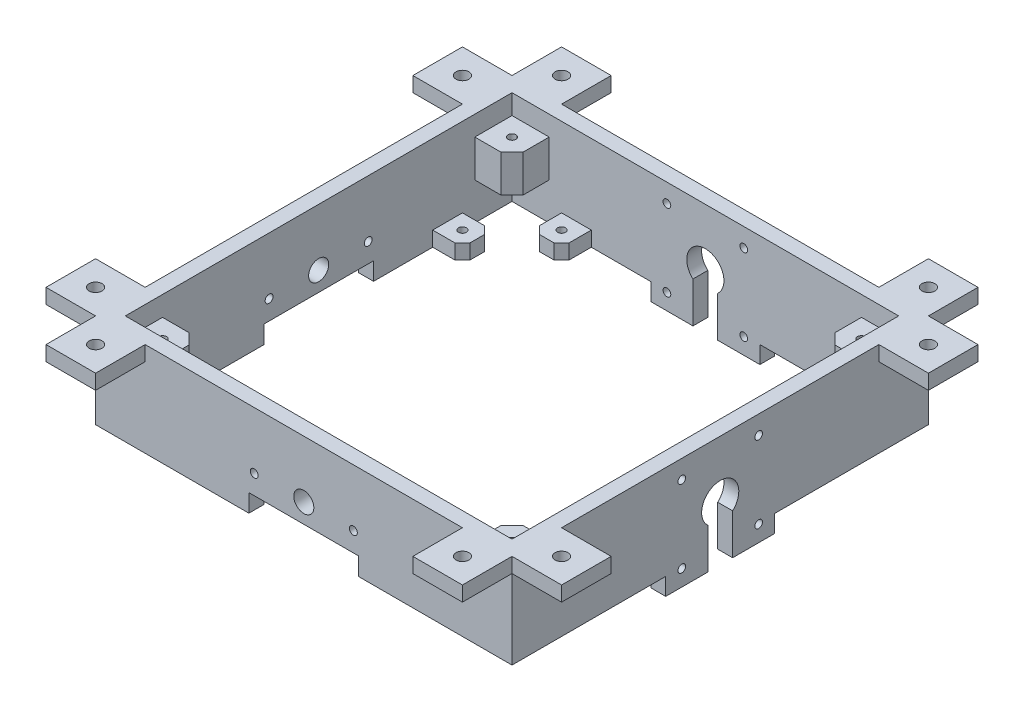
from build123d import *

# Parameters (mm, degrees)
SKETCH_1_W                           = 168
SKETCH_1_H                           = 168
SKETCH_1_W_2                         = 156
SKETCH_1_H_2                         = 156
EXTRUDE_1_DEPTH                      = 38
EXTRUDE_2_DEPTH                      = 15
SKETCH_3_R                           = 1.6
CUT_EXTRUDE_1_DEPTH                  = 122
PATTERN_CIRCULAR_1_COUNT             = 4
SKETCH_8_W                           = 20
SKETCH_8_H                           = 20
SKETCH_8_R                           = 2.6
EXTRUDE_3_DEPTH                      = 6
SKETCH_9_W                           = 20
SKETCH_9_H                           = 20
SKETCH_9_R                           = 2.6
EXTRUDE_4_DEPTH                      = 6
PATTERN_CIRCULAR_2_COUNT             = 4
SKETCH_10_W                          = 44
SKETCH_10_H                          = 7
EXTRUDE_5_DEPTH                      = 6
SKETCH_11_R                          = 1.55
CUT_EXTRUDE_3_DEPTH                  = 6
PATTERN_CIRCULAR_3_COUNT             = 2
PATTERN_CIRCULAR_3_ANGLE             = 90
SKETCH_12_R                          = 4.05
SKETCH_12_W                          = 44.3
SKETCH_12_H                          = 7.2
CUT_EXTRUDE_4_DEPTH                  = 6
SKETCH_16_R                          = 1.6
CUT_EXTRUDE_6_DEPTH                  = 6
PATTERN_CIRCULAR_4_COUNT             = 2
PATTERN_CIRCULAR_4_ANGLE             = 90
SKETCH_13_W                          = 12
SKETCH_13_H                          = 12
EXTRUDE_6_DEPTH                      = 6
SKETCH_15_R                          = 1.6
CUT_EXTRUDE_5_DEPTH                  = 6
CHAMFER_1_SIZE                       = 3
PATTERN_CIRCULAR_5_COUNT             = 4
CHAMFER_1_OF_PATTERN_CIRCULAR_5_SIZE = 3


with BuildPart() as part:
    # 草图1 → 凸台-拉伸1 (new body)
    with BuildSketch(Plane(origin=(0, 0, 0), x_dir=(1, 0, 0), z_dir=(0, 1, 0))):
        Rectangle(SKETCH_1_W, SKETCH_1_H)
        Rectangle(SKETCH_1_W_2, SKETCH_1_H_2, mode=Mode.SUBTRACT)
    extrude(amount=EXTRUDE_1_DEPTH)

    # 草图2 → 凸台-拉伸2 (add)
    with BuildSketch(Plane(origin=(0, 30, 0), x_dir=(1, 0, 0), z_dir=(0, 1, 0))):
        Polygon((-67.384062043, 63), (-78, 63), (-78, 78), (-63, 78), (-63, 67.384062043), align=None)
        Polygon((67.384062043, 63), (63, 67.384062043), (63, 78), (78, 78), (78, 63), align=None)
        Polygon((63, -67.384062043), (67.384062043, -63), (78, -63), (78, -78), (63, -78), align=None)
        Polygon((-67.384062043, -63), (-63, -67.384062043), (-63, -78), (-78, -78), (-78, -63), align=None)
    extrude(amount=-EXTRUDE_2_DEPTH)

    # 草图3 → 切除-拉伸1 (cut, through all)
    with BuildSketch(Plane(origin=(0, 15, 0), x_dir=(-1, 0, 0), z_dir=(0, -1, 0))):
        with Locations(Location((70.5, 70.5, 0), (0, 0, 90))):
            Circle(SKETCH_3_R)
    cut_extrude_1 = extrude(amount=-CUT_EXTRUDE_1_DEPTH, mode=Mode.SUBTRACT)

    # 阵列(圆周)1: 切除-拉伸1 ×4 about axis
    pattern_circular_1_axis = Axis((0, 0, 0), (0, 1, 0))
    for i in range(1, PATTERN_CIRCULAR_1_COUNT):
        add(cut_extrude_1.rotate(pattern_circular_1_axis, i * 360 / PATTERN_CIRCULAR_1_COUNT), mode=Mode.SUBTRACT)

    # 草图8 → 凸台-拉伸3 (add)
    with BuildSketch(Plane(origin=(0, 38, 0), x_dir=(1, 0, 0), z_dir=(0, 1, 0))):
        with Locations((-94, 74)):
            Rectangle(SKETCH_8_W, SKETCH_8_H)
        with Locations(Location((-94, 74, 0), (0, 0, 270))):
            Circle(SKETCH_8_R, mode=Mode.SUBTRACT)
    extrude_3 = extrude(amount=-EXTRUDE_3_DEPTH)

    # 草图9 → 凸台-拉伸4 (add)
    with BuildSketch(Plane(origin=(0, 38, 0), x_dir=(1, 0, 0), z_dir=(0, 1, 0))):
        with Locations((-74, 94)):
            Rectangle(SKETCH_9_W, SKETCH_9_H)
        with Locations(Location((-74, 94, 0), (0, 0, 270))):
            Circle(SKETCH_9_R, mode=Mode.SUBTRACT)
    extrude_4 = extrude(amount=-EXTRUDE_4_DEPTH)

    # 阵列(圆周)2: 凸台-拉伸3, 凸台-拉伸4 ×4 about axis
    pattern_circular_2_axis = Axis((0, 0, 0), (0, 1, 0))
    add([extrude_3.rotate(pattern_circular_2_axis, i * 360 / PATTERN_CIRCULAR_2_COUNT) for i in range(1, PATTERN_CIRCULAR_2_COUNT)])
    add([extrude_4.rotate(pattern_circular_2_axis, i * 360 / PATTERN_CIRCULAR_2_COUNT) for i in range(1, PATTERN_CIRCULAR_2_COUNT)])

    # 草图10 → 凸台-拉伸5 (add)
    with BuildSketch(Plane(origin=(0, 0, -84), x_dir=(-1, 0, 0), z_dir=(0, 0, -1))):
        with Locations((0, -3.5)):
            Rectangle(SKETCH_10_W, SKETCH_10_H)
    extrude_5 = extrude(amount=-EXTRUDE_5_DEPTH)

    # 草图11 → 切除-拉伸3 (cut)
    with BuildSketch(Plane(origin=(0, 0, -84), x_dir=(-1, 0, 0), z_dir=(0, 0, -1))):
        with Locations((-15.5, 30.5)):
            Circle(SKETCH_11_R)
        with Locations(Location((15.5, 30.5, 0), (0, 0, 180))):
            Circle(SKETCH_11_R)
        with Locations((15.5, -0.5)):
            Circle(SKETCH_11_R)
        with Locations(Location((-15.5, -0.5, 0), (0, 0, 180))):
            Circle(SKETCH_11_R)
        with BuildLine():
            Line((-5, -7), (-5, 9.409830056))
            ThreePointArc((-5, 9.409830056), (0, 22.5), (5, 9.409830056))
            Line((5, 9.409830056), (5, -7))
            Line((5, -7), (-5, -7))
        make_face()
    cut_extrude_3 = extrude(amount=-CUT_EXTRUDE_3_DEPTH, mode=Mode.SUBTRACT)

    # 阵列(圆周)3: 凸台-拉伸5, 切除-拉伸3 ×2 about axis
    pattern_circular_3_axis = Axis((0, 0, 0), (0, -1, 0))
    add([extrude_5.rotate(pattern_circular_3_axis, i * PATTERN_CIRCULAR_3_ANGLE / (PATTERN_CIRCULAR_3_COUNT - 1)) for i in range(1, PATTERN_CIRCULAR_3_COUNT)])
    add([cut_extrude_3.rotate(pattern_circular_3_axis, i * PATTERN_CIRCULAR_3_ANGLE / (PATTERN_CIRCULAR_3_COUNT - 1)) for i in range(1, PATTERN_CIRCULAR_3_COUNT)], mode=Mode.SUBTRACT)

    # 草图12 → 切除-拉伸4 (cut)
    with BuildSketch(Plane.XY.offset(84)):
        with Locations((0, 15)):
            Circle(SKETCH_12_R)
        with Locations((0, 3.6)):
            Rectangle(SKETCH_12_W, SKETCH_12_H)
    cut_extrude_4 = extrude(amount=-CUT_EXTRUDE_4_DEPTH, mode=Mode.SUBTRACT)

    # 草图16 → 切除-拉伸6 (cut)
    with BuildSketch(Plane.XY.offset(84)):
        with Locations((-20, 15)):
            Circle(SKETCH_16_R)
        with Locations(Location((20, 15, 0), (0, 0, 180))):
            Circle(SKETCH_16_R)
    cut_extrude_6 = extrude(amount=-CUT_EXTRUDE_6_DEPTH, mode=Mode.SUBTRACT)

    # 阵列(圆周)4: 切除-拉伸4, 切除-拉伸6 ×2 about axis
    pattern_circular_4_axis = Axis((0, 0, 0), (0, -1, 0))
    add([cut_extrude_4.rotate(pattern_circular_4_axis, i * PATTERN_CIRCULAR_4_ANGLE / (PATTERN_CIRCULAR_4_COUNT - 1)) for i in range(1, PATTERN_CIRCULAR_4_COUNT)], mode=Mode.SUBTRACT)
    add([cut_extrude_6.rotate(pattern_circular_4_axis, i * PATTERN_CIRCULAR_4_ANGLE / (PATTERN_CIRCULAR_4_COUNT - 1)) for i in range(1, PATTERN_CIRCULAR_4_COUNT)], mode=Mode.SUBTRACT)

    # 草图13 → 凸台-拉伸6 (add)
    with BuildSketch(Plane.XZ):
        with Locations((-72, 52)):
            Rectangle(SKETCH_13_W, SKETCH_13_H)
        with Locations((-52, 72)):
            Rectangle(SKETCH_13_W, SKETCH_13_H)
    extrude_6 = extrude(amount=-EXTRUDE_6_DEPTH)

    # 草图15 → 切除-拉伸5 (cut)
    with BuildSketch(Plane.XZ):
        with Locations(Location((-72, 52, 0), (0, 0, 270))):
            Circle(SKETCH_15_R)
        with Locations(Location((-52, 72, 0), (0, 0, 90))):
            Circle(SKETCH_15_R)
    cut_extrude_5 = extrude(amount=-CUT_EXTRUDE_5_DEPTH, mode=Mode.SUBTRACT)

    # 倒角1
    chamfer_1_edges = [part.edges().sort_by_distance(p)[0] for p in [
        (-66, 3, 58),
        (-66, 3, 46),
        (-46, 3, 66),
        (-58, 3, 66),
    ]]
    chamfer(chamfer_1_edges, length=CHAMFER_1_SIZE)

    # 阵列(圆周)5: 凸台-拉伸6, 切除-拉伸5 ×4 about axis
    pattern_circular_5_axis = Axis((0, 0, 0), (0, 1, 0))
    add([extrude_6.rotate(pattern_circular_5_axis, i * 360 / PATTERN_CIRCULAR_5_COUNT) for i in range(1, PATTERN_CIRCULAR_5_COUNT)])
    add([cut_extrude_5.rotate(pattern_circular_5_axis, i * 360 / PATTERN_CIRCULAR_5_COUNT) for i in range(1, PATTERN_CIRCULAR_5_COUNT)], mode=Mode.SUBTRACT)

    # 倒角1 of 阵列(圆周)5
    chamfer_1_of_pattern_circular_5_edges = [part.edges().sort_by_distance(p)[0] for p in [
        (58, 3, 66),
        (46, 3, 66),
        (66, 3, 46),
        (66, 3, 58),
        (66, 3, -58),
        (66, 3, -46),
        (46, 3, -66),
        (58, 3, -66),
        (-58, 3, -66),
        (-46, 3, -66),
        (-66, 3, -46),
        (-66, 3, -58),
    ]]
    chamfer(chamfer_1_of_pattern_circular_5_edges, length=CHAMFER_1_OF_PATTERN_CIRCULAR_5_SIZE)


solid = part.part
